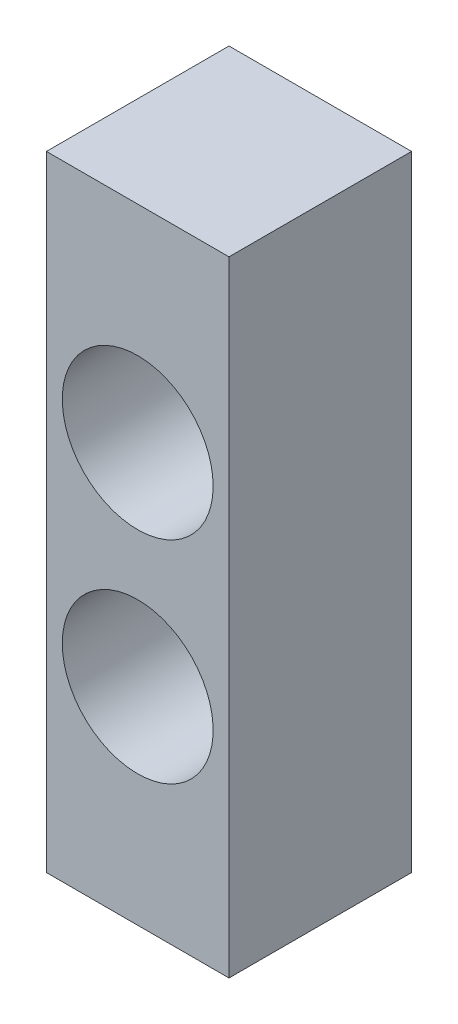
from build123d import *

# Parameters (mm, degrees)
SKETCH1_W           = 9.652
SKETCH1_H           = 9.652
BOSS_EXTRUDE1_DEPTH = 33.02
SKETCH2_R           = 3.9878
CUT_EXTRUDE1_DEPTH  = 35.738620871


with BuildPart() as part:
    # Sketch1 → Boss-Extrude1 (new body)
    with BuildSketch(Plane(origin=(0, 0, 0), x_dir=(1, 0, 0), z_dir=(0, 1, 0))):
        Rectangle(SKETCH1_W, SKETCH1_H)
    extrude(amount=BOSS_EXTRUDE1_DEPTH)

    # Sketch2 → Cut-Extrude1 (cut, through all)
    with BuildSketch(Plane.XY.offset(4.826)):
        with Locations((0, 22.098)):
            Circle(SKETCH2_R)
        with Locations(Location((0, 10.922, 0), (0, 0, 180))):
            Circle(SKETCH2_R)
    extrude(amount=-CUT_EXTRUDE1_DEPTH, mode=Mode.SUBTRACT)


solid = part.part
